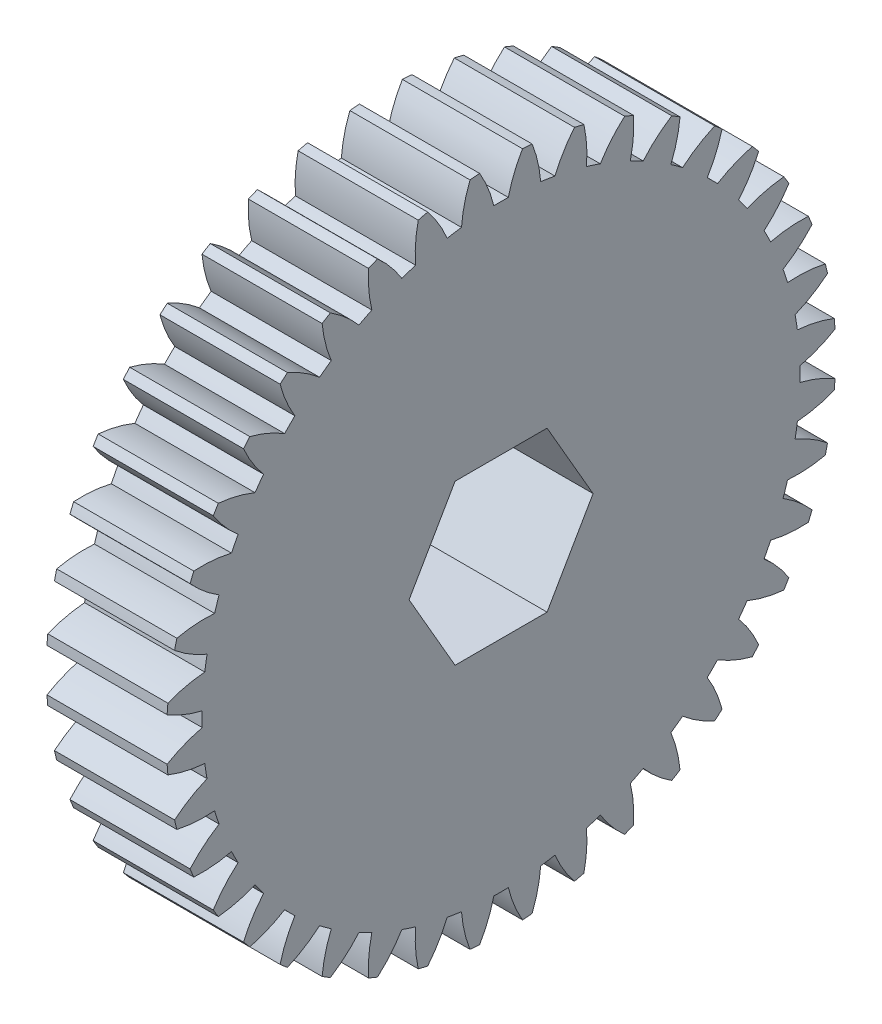
from build123d import *

# Parameters (mm, degrees)
BASPROSKE_W        = 9.5758
BASPROSKE_H        = 26.67
TOOTHCUT_DEPTH     = 39.913670421
TEETHCUTS_COUNT    = 40
TEETHCUTS_ANGLE    = 351
HUBNEAONESKE_R     = 8.9281
HUBNEARONE_DEPTH   = 0.6096508
BORSKE_R           = 6.35
BORE_DEPTH         = 10.1854508
CUT_EXTRUDE1_DEPTH = 39.993527219


with BuildPart() as part:
    # BasProSke → Base-Revolve (revolve)
    with BuildSketch(Plane(origin=(0, 0, 0), x_dir=(1, 0, 0), z_dir=(0, 1, 0)), mode=Mode.PRIVATE) as base_revolve_sk:
        with Locations((4.7879, 13.335)):
            Rectangle(BASPROSKE_W, BASPROSKE_H)
    revolve(base_revolve_sk.sketch.rotate(Axis((-10, 0, 0), (1, 0, 0)), 180), axis=Axis((-10, 0, 0), (1, 0, 0)))

    # TooCutSke → ToothCut (cut, through all)
    with BuildSketch(Plane(origin=(0, 0, 0), x_dir=(0, 0, -1), z_dir=(1, 0, 0))):
        with BuildLine():
            ThreePointArc((0.577296327, 23.818204886), (0, 23.8252), (-0.577296327, 23.818204886))
            ThreePointArc((-0.577296327, 23.818204886), (-1.042980967, 25.272123589), (-1.721261603, 26.639850594))
            ThreePointArc((-1.721261603, 26.639850594), (0, 26.6954), (1.721261603, 26.639850594))
            ThreePointArc((1.721261603, 26.639850594), (1.042980967, 25.272123589), (0.577296327, 23.818204886))
        make_face()
    toothcut = extrude(amount=TOOTHCUT_DEPTH, mode=Mode.SUBTRACT)

    # TeethCuts: ToothCut ×40 about axis
    teethcuts_axis = Axis((-10, 0, 0), (1, 0, 0))
    for i in range(1, TEETHCUTS_COUNT):
        add(toothcut.rotate(teethcuts_axis, i * TEETHCUTS_ANGLE / (TEETHCUTS_COUNT - 1)), mode=Mode.SUBTRACT)

    # HubNeaOneSke → HubNearOne (add)
    with BuildSketch(Plane.ZY):
        with Locations(Location((0, 0, 0), (0, 0, 180))):
            Circle(HUBNEAONESKE_R)
    extrude(amount=HUBNEARONE_DEPTH)

    # BorSke → Bore (cut, symmetric)
    with BuildSketch(Plane(origin=(0, 0, 0), x_dir=(0, 0, -1), z_dir=(1, 0, 0))):
        with Locations(Location((0, 0, 0), (0, 0, 180))):
            Circle(BORSKE_R)
    extrude(amount=BORE_DEPTH, both=True, mode=Mode.SUBTRACT)

    # Sketch1 → Cut-Extrude1 (cut, through all)
    with BuildSketch(Plane(origin=(9.5758, 0, 0), x_dir=(0, 0, -1), z_dir=(1, 0, 0))):
        Polygon((3.666174209, 6.35), (-3.666174209, 6.35), (-7.332348419, 0), (-3.666174209, -6.35), (3.666174209, -6.35), (7.332348419, 0), align=None)
    extrude(amount=-CUT_EXTRUDE1_DEPTH, mode=Mode.SUBTRACT)


solid = part.part
